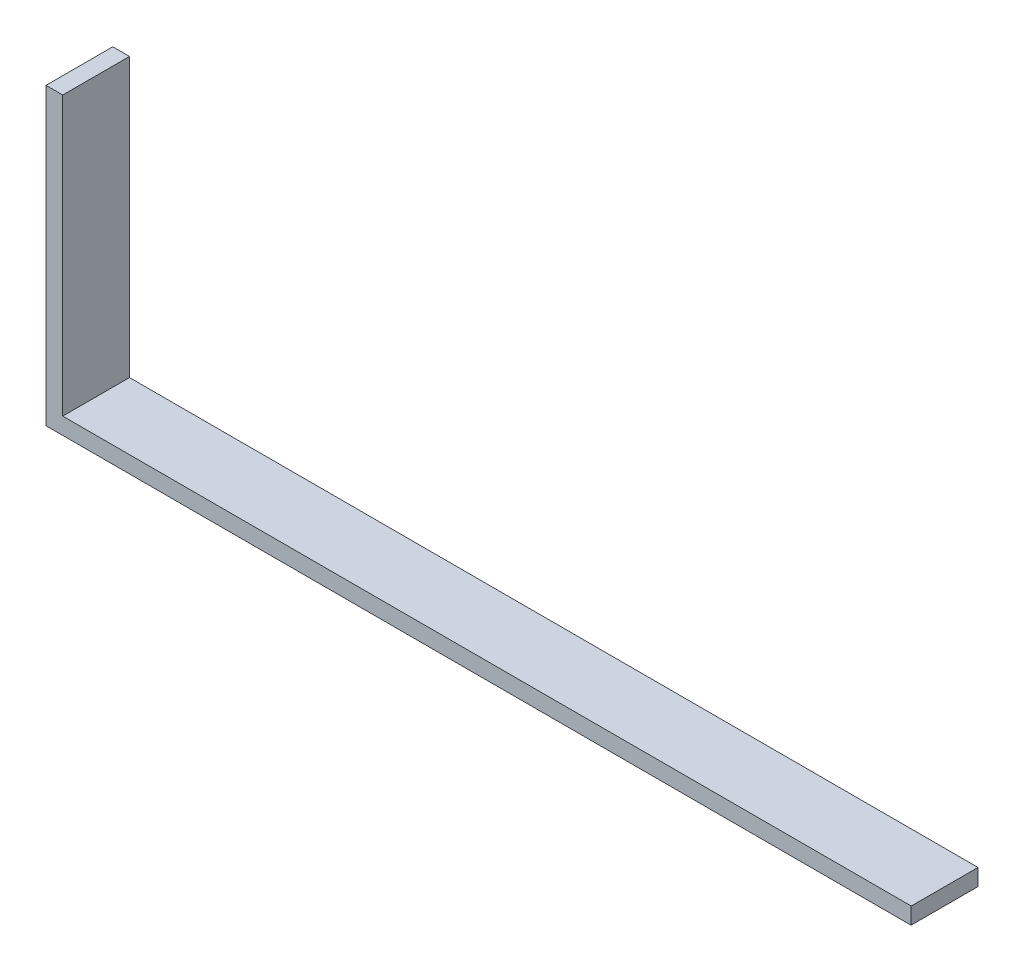
from build123d import *

# Parameters (mm, degrees)
SALIENTE_EXTRUIR1_DEPTH = 50.8


with BuildPart() as part:
    # Croquis1 → Saliente-Extruir1 (new body)
    with BuildSketch(Plane.XY):
        Polygon((645.545, -211.585), (645.445, -224.305), (-12.72, -224.305), (-12.72, 0), (0, 0), (0, -211.585), align=None)
    extrude(amount=SALIENTE_EXTRUIR1_DEPTH)


solid = part.part
